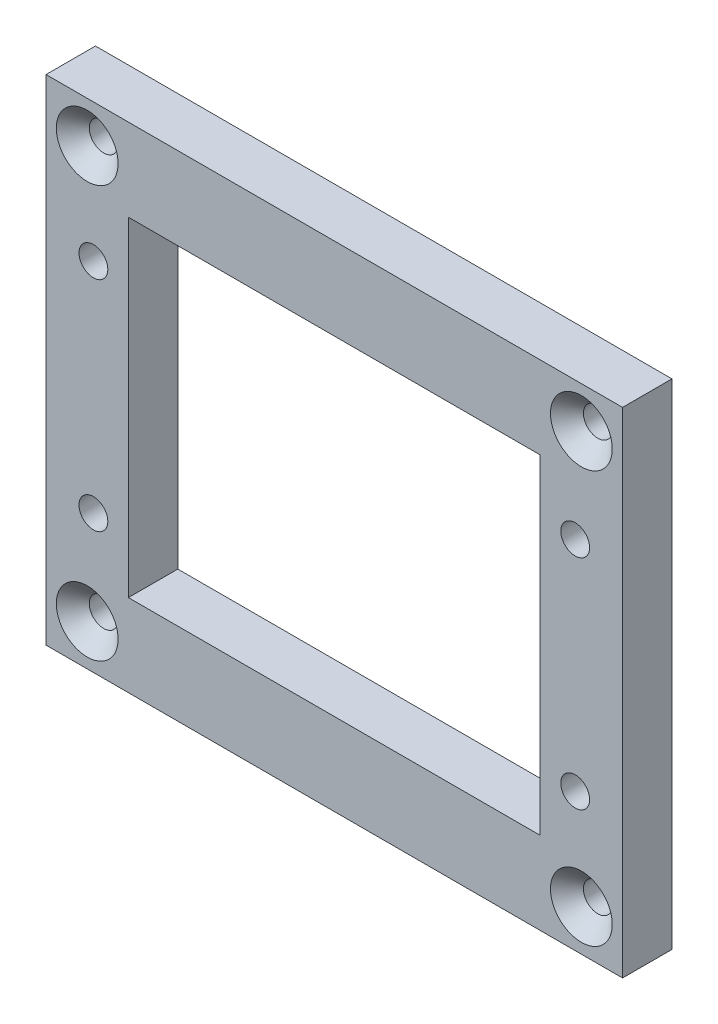
from build123d import *

# Parameters (mm, degrees)
SKETCH1_W           = 70
SKETCH1_H           = 60
SKETCH1_R           = 1.75
SKETCH1_W_2         = 50
SKETCH1_H_2         = 40
BOSS_EXTRUDE1_DEPTH = 6
CHAMFER1_SIZE       = 2
SKETCH3_R           = 3
CUT_EXTRUDE1_DEPTH  = 3


with BuildPart() as part:
    # Sketch1 → Boss-Extrude1 (new body)
    with BuildSketch(Plane.XY):
        with Locations((35, 30)):
            Rectangle(SKETCH1_W, SKETCH1_H)
        with Locations((5.75, 16.75)):
            Circle(SKETCH1_R, mode=Mode.SUBTRACT)
        with Locations((5.75, 43.25)):
            Circle(SKETCH1_R, mode=Mode.SUBTRACT)
        with Locations((64.25, 43.25)):
            Circle(SKETCH1_R, mode=Mode.SUBTRACT)
        with Locations((64.25, 16.75)):
            Circle(SKETCH1_R, mode=Mode.SUBTRACT)
        with Locations((5, 55)):
            Circle(SKETCH1_R, mode=Mode.SUBTRACT)
        with Locations((65, 55)):
            Circle(SKETCH1_R, mode=Mode.SUBTRACT)
        with Locations((65, 5)):
            Circle(SKETCH1_R, mode=Mode.SUBTRACT)
        with Locations((5, 5)):
            Circle(SKETCH1_R, mode=Mode.SUBTRACT)
        with Locations((35, 30)):
            Rectangle(SKETCH1_W_2, SKETCH1_H_2, mode=Mode.SUBTRACT)
    extrude(amount=BOSS_EXTRUDE1_DEPTH)

    # Chamfer1
    chamfer1_edges = [part.edges().sort_by_distance(p)[0] for p in [
        (3.25, 55, 6),
        (63.25, 55, 6),
        (63.25, 5, 6),
        (3.25, 5, 6),
    ]]
    chamfer(chamfer1_edges, length=CHAMFER1_SIZE)

    # Sketch3 → Cut-Extrude1 (cut)
    with BuildSketch(Plane(origin=(0, 0, 0), x_dir=(-1, 0, 0), z_dir=(0, 0, -1))):
        with Locations((-64.25, 43.25)):
            Circle(SKETCH3_R)
        with Locations((-64.25, 16.75)):
            Circle(SKETCH3_R)
        with Locations((-5.75, 16.75)):
            Circle(SKETCH3_R)
        with Locations((-5.75, 43.25)):
            Circle(SKETCH3_R)
    extrude(amount=-CUT_EXTRUDE1_DEPTH, mode=Mode.SUBTRACT)


solid = part.part
